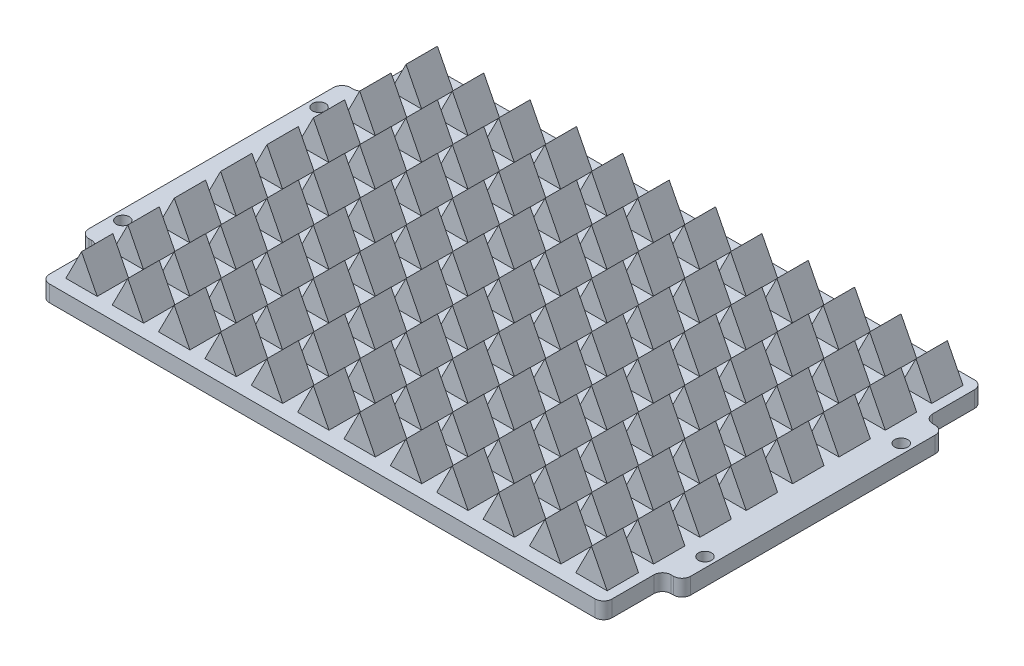
from build123d import *

# Parameters (mm, degrees)
SKETCH1_W            = 109.22
SKETCH1_H            = 73.66
BOSS_EXTRUDE1_DEPTH  = 3.175
BOSS_EXTRUDE3_DEPTH  = 3.048
LPATTERN1_COUNT      = 12
LPATTERN1_PITCH      = 9.000000034
LPATTERN1_COUNT_DIR2 = 8
LPATTERN1_PITCH_DIR2 = 9.000000034
SKETCH3_W            = 3.81
SKETCH3_H            = 50.8
SKETCH3_R            = 1.27
BOSS_EXTRUDE2_DEPTH  = 3.175
FILLET1_R            = 1.651


with BuildPart() as part:
    # Sketch1 → Boss-Extrude1 (new body)
    with BuildSketch(Plane(origin=(0, 0, 0), x_dir=(1, 0, 0), z_dir=(0, 1, 0))):
        Rectangle(SKETCH1_W, SKETCH1_H)
    extrude(amount=-BOSS_EXTRUDE1_DEPTH)

    # Sketch2 → Boss-Extrude3 (add, symmetric)
    with BuildSketch(Plane.XY.offset(-31.75)):
        Polygon((-52.324, 0), (-49.276, 6), (-46.228, 0), (-49.276, 0), align=None)
    boss_extrude3 = extrude(amount=BOSS_EXTRUDE3_DEPTH, both=True)

    # LPattern1: Boss-Extrude3 12 × 8
    with Locations(*[(i * LPATTERN1_PITCH, 0, j * LPATTERN1_PITCH_DIR2) for i in range(LPATTERN1_COUNT) for j in range(LPATTERN1_COUNT_DIR2) if (i, j) != (0, 0)]):
        add(boss_extrude3)

    # Sketch3 → Boss-Extrude2 (add)
    # profile 1 of 2: a face of its own
    with BuildSketch(Plane(origin=(0, 0, 0), x_dir=(1, 0, 0), z_dir=(0, 1, 0))):
        with Locations((-56.515, 0)):
            Rectangle(SKETCH3_W, SKETCH3_H)
        with Locations(Location((-56.515, 19.05, 0), (0, 0, 270))):
            Circle(SKETCH3_R, mode=Mode.SUBTRACT)
        with Locations(Location((-56.515, -19.05, 0), (0, 0, 270))):
            Circle(SKETCH3_R, mode=Mode.SUBTRACT)
    # profile 2 of 2: a face of its own
    with BuildSketch(Plane(origin=(0, 0, 0), x_dir=(1, 0, 0), z_dir=(0, 1, 0))):
        with Locations((56.515, 0)):
            Rectangle(SKETCH3_W, SKETCH3_H)
        with Locations(Location((56.515, -19.05, 0), (0, 0, 90))):
            Circle(SKETCH3_R, mode=Mode.SUBTRACT)
        with Locations(Location((56.515, 19.05, 0), (0, 0, 90))):
            Circle(SKETCH3_R, mode=Mode.SUBTRACT)
    extrude(amount=-BOSS_EXTRUDE2_DEPTH)

    # Fillet1
    fillet1_edges = [part.edges().sort_by_distance(p)[0] for p in [
        (54.61, -1.5875, -25.4),
        (58.42, -1.5875, -25.4),
        (58.42, -1.5875, 25.4),
        (54.61, -1.5875, 25.4),
        (54.61, -1.5875, 36.83),
        (-54.61, -1.5875, 36.83),
        (-54.61, -1.5875, -36.83),
        (54.61, -1.5875, -36.83),
        (-54.61, -1.5875, -25.4),
        (-54.61, -1.5875, 25.4),
        (-58.42, -1.5875, 25.4),
        (-58.42, -1.5875, -25.4),
    ]]
    fillet(fillet1_edges, radius=FILLET1_R)


solid = part.part
